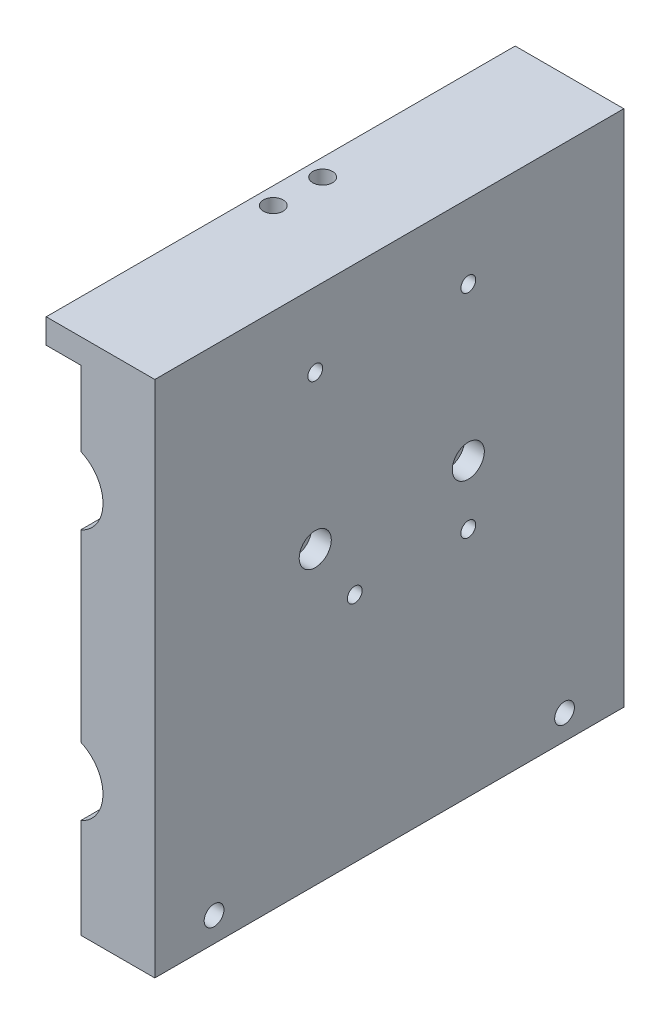
from build123d import *

# Parameters (mm, degrees)
BOSS_EXTRUDE1_DEPTH                = 95
SKETCH2_R                          = 2
CUT_EXTRUDE1_3DPRINTER4_DEPTH      = 139.744369255
ESQUISSE1_R                        = 1.5
ENL_V_MAT_EXTRU_1_3D_PRINTER_DEPTH = 140.67462189
ENL_V_MAT_EXTRU_2_DEPTH            = 139.744369255
ENL_V_MAT_EXTRU_2_DEPTH_BACK       = 3
ESQUISSE2_R                        = 2.5
ESQUISSE3_R                        = 3.25
ENL_V_MAT_EXTRU_3_DEPTH            = 4
ESQUISSE4_R                        = 2
ENL_V_MAT_EXTRU_4_DEPTH            = 140.67462189
ESQUISSE8_R                        = 7.5
ENL_V_MAT_EXTRU_9_DEPTH            = 139.744369255
ESQUISSE10_R                       = 2
ENL_V_MAT_EXTRU_10_DEPTH           = 139.744369255
ESQUISSE11_R                       = 2.5
ENL_V_MAT_EXTRU_11_DEPTH           = 5
ESQUISSE12_R                       = 3
ENL_V_MAT_EXTRU_12_DEPTH           = 4


with BuildPart() as part:
    # Sketch1 → Boss-Extrude1 (new body)
    with BuildSketch(Plane.XY):
        Polygon((0, 0), (0, -37.75), (0, -100), (15, -100), (15, 5), (-7, 5), (-7, 0), align=None)
    extrude(amount=BOSS_EXTRUDE1_DEPTH)

    # Sketch2 → Cut-Extrude1 3dprinter4 (cut, through all)
    with BuildSketch(Plane.ZY):
        with Locations(Location((62.5, -41, 0), (0, 0, 270))):
            Circle(SKETCH2_R)
        with Locations(Location((31.5, -41, 0), (0, 0, 270))):
            Circle(SKETCH2_R)
    extrude(amount=-CUT_EXTRUDE1_3DPRINTER4_DEPTH, mode=Mode.SUBTRACT)

    # Esquisse1 → Enlèv. mat.-Extru.1 3d printer (cut, through all)
    with BuildSketch(Plane(origin=(15, 0, 0), x_dir=(0, 0, -1), z_dir=(1, 0, 0))):
        with Locations(Location((-62.5, -10, 0), (0, 0, 90))):
            Circle(ESQUISSE1_R)
        with Locations(Location((-31.5, -10, 0), (0, 0, 90))):
            Circle(ESQUISSE1_R)
        with Locations(Location((-54.5, -53, 0), (0, 0, 90))):
            Circle(ESQUISSE1_R)
        with Locations(Location((-31.5, -53, 0), (0, 0, 90))):
            Circle(ESQUISSE1_R)
    extrude(amount=-ENL_V_MAT_EXTRU_1_3D_PRINTER_DEPTH, mode=Mode.SUBTRACT)

    # Esquisse2 → Enlèv. mat.-Extru.2 (cut, two sides: drawn at the far end of the back side and taken through both)
    with BuildSketch(Plane.ZY.offset(-ENL_V_MAT_EXTRU_2_DEPTH_BACK)):
        with Locations(Location((62.5, -10, 0), (0, 0, 90))):
            Circle(ESQUISSE2_R)
        with Locations(Location((31.5, -10, 0), (0, 0, 90))):
            Circle(ESQUISSE2_R)
    extrude(amount=ENL_V_MAT_EXTRU_2_DEPTH + ENL_V_MAT_EXTRU_2_DEPTH_BACK, mode=Mode.SUBTRACT)

    # Esquisse3 → Enlèv. mat.-Extru.3 (cut)
    with BuildSketch(Plane(origin=(15, 0, 0), x_dir=(0, 0, -1), z_dir=(1, 0, 0))):
        with Locations(Location((-31.5, -41, 0), (0, 0, 90))):
            Circle(ESQUISSE3_R)
        with Locations(Location((-62.5, -41, 0), (0, 0, 90))):
            Circle(ESQUISSE3_R)
    extrude(amount=-ENL_V_MAT_EXTRU_3_DEPTH, mode=Mode.SUBTRACT)

    # Esquisse4 → Enlèv. mat.-Extru.4 (cut, through all)
    with BuildSketch(Plane(origin=(15, 0, 0), x_dir=(0, 0, -1), z_dir=(1, 0, 0))):
        with Locations(Location((-83, -95, 0), (0, 0, 90))):
            Circle(ESQUISSE4_R)
        with Locations(Location((-12, -95, 0), (0, 0, 90))):
            Circle(ESQUISSE4_R)
    extrude(amount=-ENL_V_MAT_EXTRU_4_DEPTH, mode=Mode.SUBTRACT)

    # Esquisse8 → Enlèv. mat.-Extru.9 (cut, through all)
    with BuildSketch(Plane(origin=(0, 0, 0), x_dir=(-1, 0, 0), z_dir=(0, 0, -1))):
        with Locations((3, -22)):
            Circle(ESQUISSE8_R)
        with Locations((3, -73)):
            Circle(ESQUISSE8_R)
    extrude(amount=-ENL_V_MAT_EXTRU_9_DEPTH, mode=Mode.SUBTRACT)

    # Esquisse10 → Enlèv. mat.-Extru.10 (cut, through all)
    with BuildSketch(Plane.XZ):
        with Locations(Location((-3.5, 52.5, 0), (0, 0, 270))):
            Circle(ESQUISSE10_R)
        with Locations(Location((-3.5, 42.5, 0), (0, 0, 270))):
            Circle(ESQUISSE10_R)
    extrude(amount=-ENL_V_MAT_EXTRU_10_DEPTH, mode=Mode.SUBTRACT)

    # Esquisse11 → Enlèv. mat.-Extru.11 (cut)
    with BuildSketch(Plane.ZY):
        with Locations(Location((54.5, -53, 0), (0, 0, 270))):
            Circle(ESQUISSE11_R)
        with Locations(Location((31.5, -53, 0), (0, 0, 270))):
            Circle(ESQUISSE11_R)
    extrude(amount=-ENL_V_MAT_EXTRU_11_DEPTH, mode=Mode.SUBTRACT)

    # Esquisse12 → Enlèv. mat.-Extru.12 (cut)
    with BuildSketch(Plane.ZY):
        with Locations(Location((62.5, -41, 0), (0, 0, 270))):
            Circle(ESQUISSE12_R)
        with Locations(Location((31.5, -41, 0), (0, 0, 270))):
            Circle(ESQUISSE12_R)
    extrude(amount=-ENL_V_MAT_EXTRU_12_DEPTH, mode=Mode.SUBTRACT)


solid = part.part
